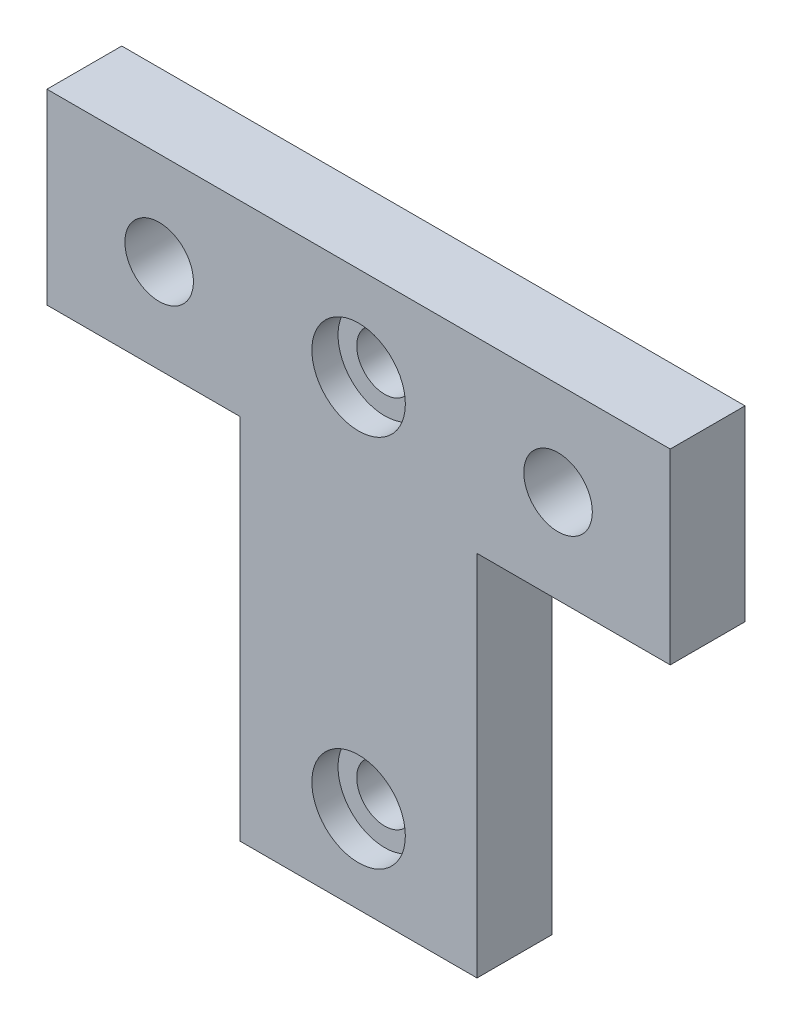
from build123d import *

# Parameters (mm, degrees)
SKETCH7_W           = 50
SKETCH7_H           = 15
SKETCH7_R           = 2.25
SKETCH7_R_2         = 2.75
SKETCH7_W_2         = 19
SKETCH7_H_2         = 29.5
BOSS_EXTRUDE3_DEPTH = 6
SKETCH8_R           = 3.75
CUT_EXTRUDE4_DEPTH  = 2.1


with BuildPart() as part:
    # Sketch7 → Boss-Extrude3 (new body)
    # profile 1 of 2: a face of its own
    with BuildSketch(Plane.XY):
        Rectangle(SKETCH7_W, SKETCH7_H)
        Circle(SKETCH7_R, mode=Mode.SUBTRACT)
        with Locations((-16, 0)):
            Circle(SKETCH7_R_2, mode=Mode.SUBTRACT)
        with Locations((16, 0)):
            Circle(SKETCH7_R_2, mode=Mode.SUBTRACT)
    # profile 2 of 2: a face of its own
    with BuildSketch(Plane.XY):
        with Locations((0, -22.25)):
            Rectangle(SKETCH7_W_2, SKETCH7_H_2)
        with Locations((0, -30)):
            Circle(SKETCH7_R, mode=Mode.SUBTRACT)
    extrude(amount=BOSS_EXTRUDE3_DEPTH)

    # Sketch8 → Cut-Extrude4 (cut)
    with BuildSketch(Plane.XY.offset(6)):
        Circle(SKETCH8_R)
        with Locations((0, -30)):
            Circle(SKETCH8_R)
    extrude(amount=-CUT_EXTRUDE4_DEPTH, mode=Mode.SUBTRACT)


solid = part.part
